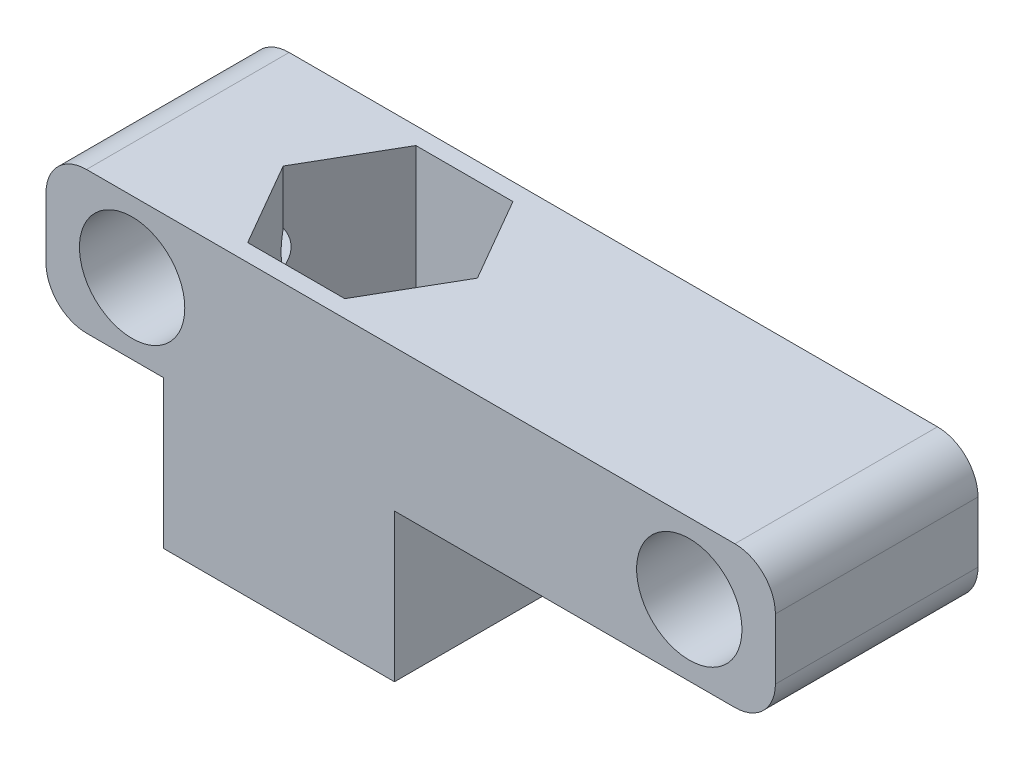
from build123d import *

# Parameters (mm, degrees)
CROQUIS1_W              = 36
CROQUIS1_H              = 7
CROQUIS1_R              = 2.6
SALIENTE_EXTRUIR1_DEPTH = 10
CORTAR_EXTRUIR1_DEPTH   = 7
CROQUIS4_W              = 11.4
CROQUIS4_H              = 10
SALIENTE_EXTRUIR2_DEPTH = 5
REDONDEO1_R             = 2
CROQUIS5_W              = 11.4
CROQUIS5_H              = 10
CROQUIS5_R              = 3.25
SALIENTE_EXTRUIR3_DEPTH = 2.3


with BuildPart() as part:
    # Croquis1 → Saliente-Extruir1 (new body)
    with BuildSketch(Plane.XY):
        with Locations((-28.016694491, 12.37804878)):
            Rectangle(CROQUIS1_W, CROQUIS1_H)
        with Locations((-41.766694491, 12.37804878)):
            Circle(CROQUIS1_R, mode=Mode.SUBTRACT)
        with Locations((-14.266694491, 12.37804878)):
            Circle(CROQUIS1_R, mode=Mode.SUBTRACT)
    extrude(amount=SALIENTE_EXTRUIR1_DEPTH)

    # Croquis2 → Cortar-Extruir1 (cut)
    with BuildSketch(Plane.XZ.offset(-8.87804878)):
        Polygon((-29.724687257, 5), (-32.120690874, 9.15), (-36.912698108, 9.15), (-39.308701725, 5), (-36.912698108, 0.85), (-32.120690874, 0.85), align=None)
    extrude(amount=-CORTAR_EXTRUIR1_DEPTH, mode=Mode.SUBTRACT)

    # Croquis4 → Saliente-Extruir2 (add)
    with BuildSketch(Plane.XZ.offset(-8.87804878)):
        with Locations((-34.516694491, 5)):
            Rectangle(CROQUIS4_W, CROQUIS4_H)
        Polygon((-29.724687257, 5), (-32.120690874, 9.15), (-36.912698108, 9.15), (-39.308701725, 5), (-36.912698108, 0.85), (-32.120690874, 0.85), align=None, mode=Mode.SUBTRACT)
    extrude(amount=SALIENTE_EXTRUIR2_DEPTH)

    # Redondeo1
    redondeo1_edges = [part.edges().sort_by_distance(p)[0] for p in [
        (-10.016694491, 15.87804878, 5),
        (-10.016694491, 8.87804878, 5),
        (-46.016694491, 8.87804878, 5),
        (-46.016694491, 15.87804878, 5),
    ]]
    fillet(redondeo1_edges, radius=REDONDEO1_R)

    # Croquis5 → Saliente-Extruir3 (add)
    with BuildSketch(Plane.XZ.offset(-3.87804878)):
        with Locations((-34.516694491, 5)):
            Rectangle(CROQUIS5_W, CROQUIS5_H)
        with Locations(Location((-34.516694491, 5, 0), (0, 0, 270))):
            Circle(CROQUIS5_R, mode=Mode.SUBTRACT)
    extrude(amount=SALIENTE_EXTRUIR3_DEPTH)


solid = part.part
